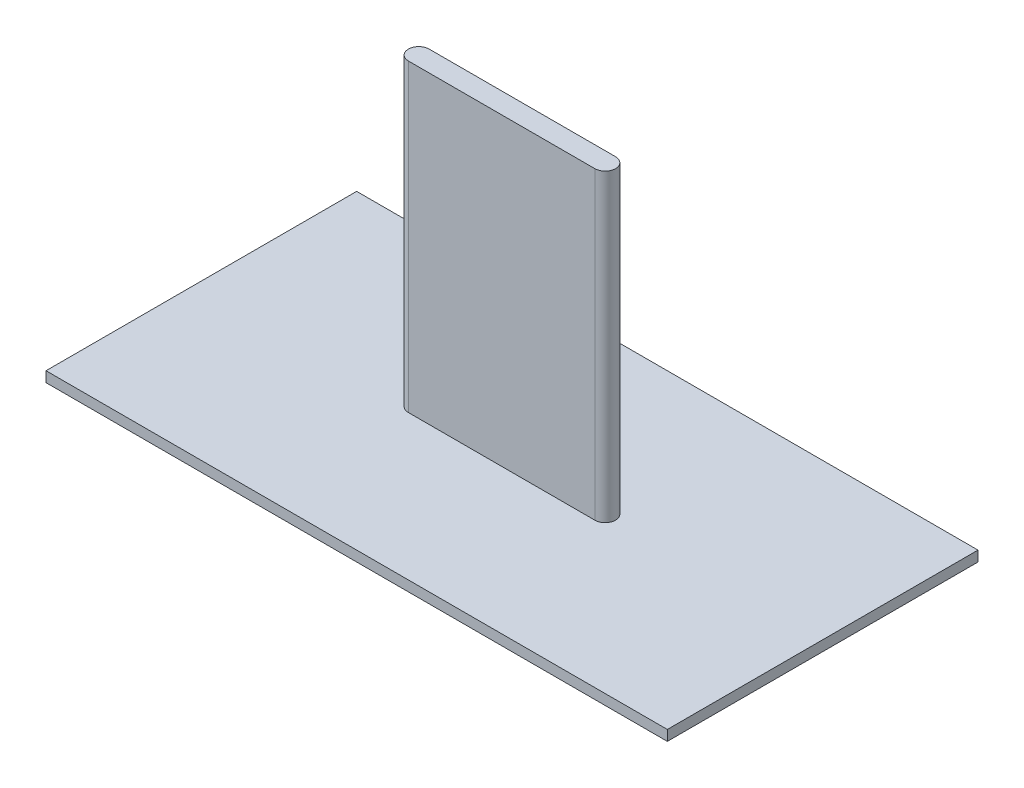
from build123d import *

# Parameters (mm, degrees)
SKETCH1_W           = 300
SKETCH1_H           = 150
BOSS_EXTRUDE1_DEPTH = 5
BOSS_EXTRUDE2_DEPTH = 147


with BuildPart() as part:
    # Sketch1 → Boss-Extrude1 (new body)
    with BuildSketch(Plane(origin=(0, 0, 0), x_dir=(1, 0, 0), z_dir=(0, 1, 0))):
        Rectangle(SKETCH1_W, SKETCH1_H)
    extrude(amount=BOSS_EXTRUDE1_DEPTH)

    # Sketch2 → Boss-Extrude2 (add)
    with BuildSketch(Plane(origin=(0, 5, 0), x_dir=(1, 0, 0), z_dir=(0, 1, 0))):
        with BuildLine():
            Line((-45, 5), (45, 5))
            ThreePointArc((45, 5), (50, 0), (45, -5))
            Line((45, -5), (-45, -5))
            ThreePointArc((-45, -5), (-50, 0), (-45, 5))
        make_face()
    extrude(amount=BOSS_EXTRUDE2_DEPTH)


solid = part.part
